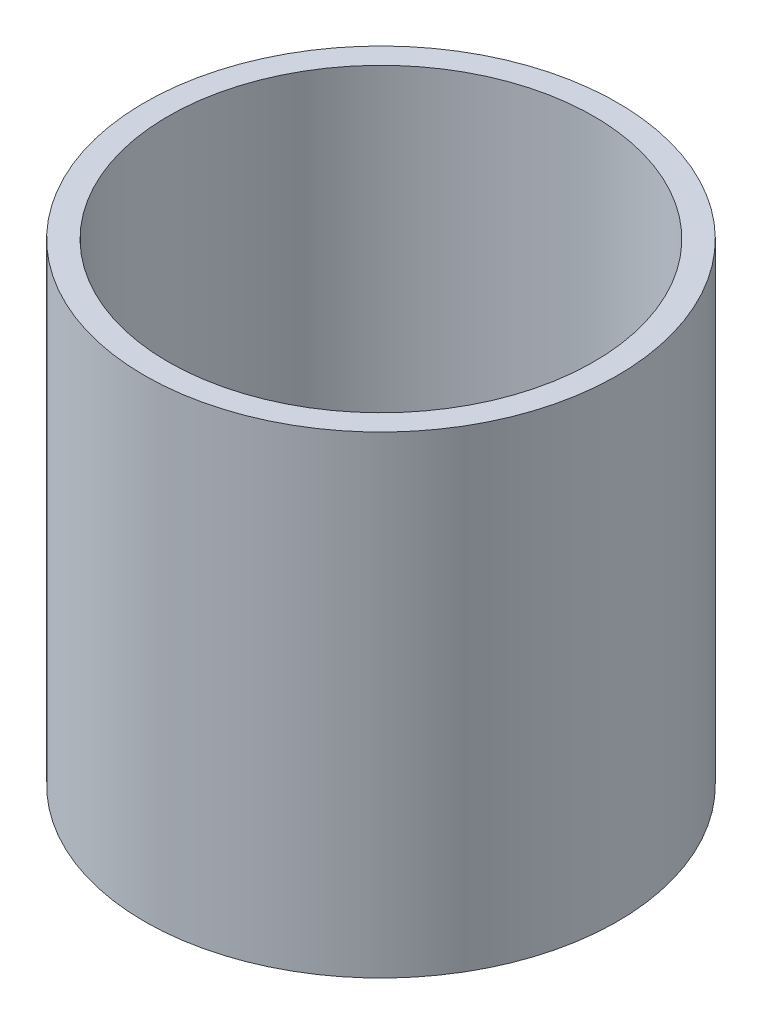
from build123d import *

# Parameters (mm, degrees)
ESBO_O1_R                = 25
RESSALTO_EXTRUS_O1_DEPTH = 50
ESBO_O2_R                = 22.5
CORTE_EXTRUS_O1_DEPTH    = 47.5


with BuildPart() as part:
    # Esboço1 → Ressalto-extrusão1 (new body)
    with BuildSketch(Plane(origin=(0, 0, 0), x_dir=(1, 0, 0), z_dir=(0, 1, 0))):
        with Locations(Location((0, 0, 0), (0, 0, 270))):
            Circle(ESBO_O1_R)
    extrude(amount=RESSALTO_EXTRUS_O1_DEPTH)

    # Esboço2 → Corte-extrusão1 (cut)
    with BuildSketch(Plane(origin=(0, 50, 0), x_dir=(1, 0, 0), z_dir=(0, 1, 0))):
        with Locations(Location((0, 0, 0), (0, 0, 270))):
            Circle(ESBO_O2_R)
    extrude(amount=-CORTE_EXTRUS_O1_DEPTH, mode=Mode.SUBTRACT)


solid = part.part
